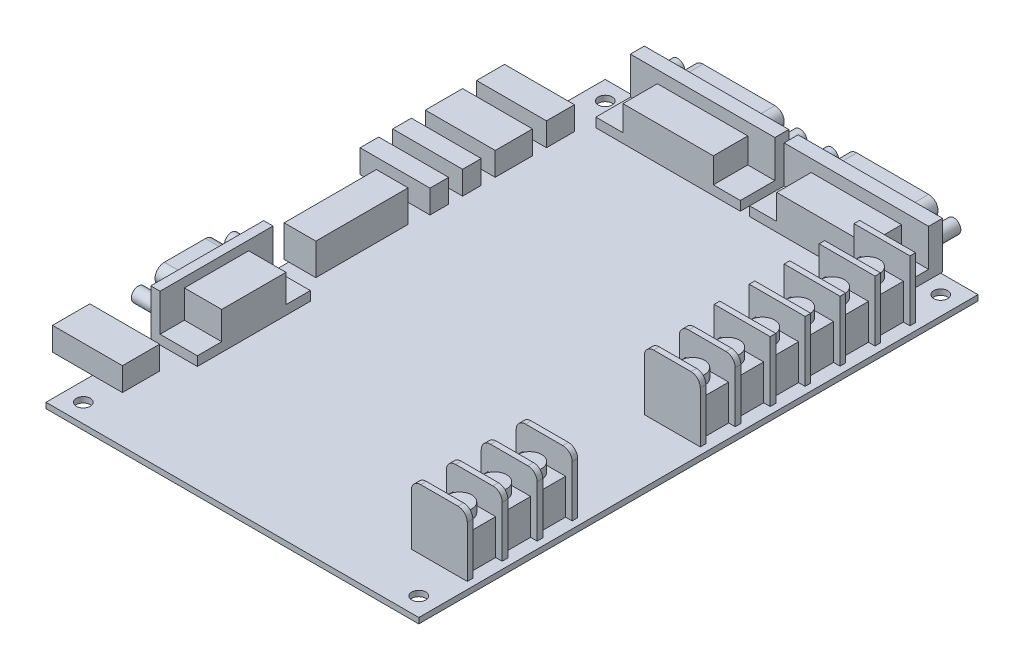
from build123d import *

# Parameters (mm, degrees)
SKETCH1_W              = 101.6
SKETCH1_H              = 152.4
SKETCH1_R              = 1.905
BOSS_EXTRUDE1_DEPTH    = 1.524
SKETCH2_W              = 11.684
SKETCH2_H              = 28.575
SKETCH2_H_2            = 57.15
BOSS_EXTRUDE2_DEPTH    = 9.652
SKETCH3_W              = 15.24
SKETCH3_H              = 1.524
BOSS_EXTRUDE3_DEPTH    = 16.51
FILLET1_R              = 2.54
SKETCH4_R              = 3.302
BOSS_EXTRUDE4_DEPTH    = 2.54
SKETCH5_W              = 15.24
SKETCH5_H              = 1.524
BOSS_EXTRUDE5_DEPTH    = 16.51
FILLET2_R              = 2.54
LPATTERN1_COUNT        = 3
LPATTERN1_PITCH        = 9.525
FILLET2_OF_LPATTERN1_R = 2.54
SKETCH6_W              = 15.24
SKETCH6_H              = 1.524
BOSS_EXTRUDE6_DEPTH    = 16.51
SKETCH7_R              = 3.302
BOSS_EXTRUDE7_DEPTH    = 2.54
FILLET3_R              = 2.54
LPATTERN2_COUNT        = 6
LPATTERN2_PITCH        = 9.525
SKETCH8_W              = 39.37
SKETCH8_H              = 13.208
BOSS_EXTRUDE8_DEPTH    = 2.54
SKETCH9_W              = 24.638
SKETCH9_H              = 13.208
BOSS_EXTRUDE9_DEPTH    = 9.398
SKETCH10_W             = 39.37
SKETCH10_H             = 3.81
BOSS_EXTRUDE10_DEPTH   = 12.7
SKETCH11_R             = 1.905
BOSS_EXTRUDE11_DEPTH   = 6.096
SKETCH12_W             = 12.7
SKETCH12_H             = 30.7848
BOSS_EXTRUDE12_DEPTH   = 2.54
SKETCH13_W             = 12.7
SKETCH13_H             = 17.526
BOSS_EXTRUDE13_DEPTH   = 10.16
SKETCH14_W             = 2.54
SKETCH14_H             = 30.7848
BOSS_EXTRUDE14_DEPTH   = 12.7
SKETCH15_R             = 1.905
BOSS_EXTRUDE15_DEPTH   = 6.096
SKETCH16_W             = 19.05
SKETCH16_H             = 7.62
SKETCH16_H_2           = 10.16
SKETCH16_H_3           = 5.08
BOSS_EXTRUDE16_DEPTH   = 6.35
SKETCH17_W             = 8.636
SKETCH17_H             = 25.146
BOSS_EXTRUDE17_DEPTH   = 8.636


with BuildPart() as part:
    # Sketch1 → Boss-Extrude1 (new body)
    with BuildSketch(Plane(origin=(0, 0, 0), x_dir=(1, 0, 0), z_dir=(0, 1, 0))):
        Rectangle(SKETCH1_W, SKETCH1_H)
        with Locations(Location((45.72, 71.12, 0), (0, 0, 90))):
            Circle(SKETCH1_R, mode=Mode.SUBTRACT)
        with Locations(Location((-45.72, 71.12, 0), (0, 0, 90))):
            Circle(SKETCH1_R, mode=Mode.SUBTRACT)
        with Locations(Location((-45.72, -71.12, 0), (0, 0, 90))):
            Circle(SKETCH1_R, mode=Mode.SUBTRACT)
        with Locations(Location((45.72, -71.12, 0), (0, 0, 90))):
            Circle(SKETCH1_R, mode=Mode.SUBTRACT)
    extrude(amount=BOSS_EXTRUDE1_DEPTH)

    # Sketch2 → Boss-Extrude2 (add)
    with BuildSketch(Plane(origin=(0, 1.524, 0), x_dir=(1, 0, 0), z_dir=(0, 1, 0))):
        with Locations((41.275, -46.0375)):
            Rectangle(SKETCH2_W, SKETCH2_H)
        with Locations((41.275, 31.75)):
            Rectangle(SKETCH2_W, SKETCH2_H_2)
    extrude(amount=BOSS_EXTRUDE2_DEPTH)

    # Sketch3 → Boss-Extrude3 (add)
    with BuildSketch(Plane(origin=(0, 1.524, 0), x_dir=(1, 0, 0), z_dir=(0, 1, 0))):
        with Locations((41.275, -60.325)):
            Rectangle(SKETCH3_W, SKETCH3_H)
        with Locations((41.275, 3.175)):
            Rectangle(SKETCH3_W, SKETCH3_H)
    extrude(amount=BOSS_EXTRUDE3_DEPTH)

    # Fillet1
    fillet1_edges = [part.edges().sort_by_distance(p)[0] for p in [
        (33.655, 18.034, 60.325),
        (48.895, 18.034, 60.325),
        (33.655, 18.034, -3.175),
        (48.895, 18.034, -3.175),
    ]]
    fillet(fillet1_edges, radius=FILLET1_R)

    # Sketch4 → Boss-Extrude4 (add)
    with BuildSketch(Plane(origin=(0, 11.176, 0), x_dir=(1, 0, 0), z_dir=(0, 1, 0))):
        with Locations(Location((41.275, -55.5498, 0), (0, 0, 270))):
            Circle(SKETCH4_R)
    boss_extrude4 = extrude(amount=BOSS_EXTRUDE4_DEPTH)

    # Sketch5 → Boss-Extrude5 (add)
    with BuildSketch(Plane(origin=(0, 1.524, 0), x_dir=(1, 0, 0), z_dir=(0, 1, 0))):
        with Locations((41.275, -50.8)):
            Rectangle(SKETCH5_W, SKETCH5_H)
    boss_extrude5 = extrude(amount=BOSS_EXTRUDE5_DEPTH)

    # Fillet2
    fillet2_edges = [part.edges().sort_by_distance(p)[0] for p in [
        (33.655, 18.034, 50.8),
        (48.895, 18.034, 50.8),
    ]]
    fillet(fillet2_edges, radius=FILLET2_R)

    # LPattern1: Boss-Extrude4, Boss-Extrude5 ×3
    with Locations(*[(0, 0, -i * LPATTERN1_PITCH) for i in range(1, LPATTERN1_COUNT)]):
        add(boss_extrude4)
        add(boss_extrude5)

    # Fillet2 of LPattern1
    fillet2_of_lpattern1_edges = [part.edges().sort_by_distance(p)[0] for p in [
        (33.655, 18.034, 41.275),
        (48.895, 18.034, 41.275),
        (33.655, 18.034, 31.75),
        (48.895, 18.034, 31.75),
    ]]
    fillet(fillet2_of_lpattern1_edges, radius=FILLET2_OF_LPATTERN1_R)

    # Sketch6 → Boss-Extrude6 (add)
    with BuildSketch(Plane(origin=(0, 1.524, 0), x_dir=(1, 0, 0), z_dir=(0, 1, 0))):
        with Locations((41.275, 12.7)):
            Rectangle(SKETCH6_W, SKETCH6_H)
    boss_extrude6 = extrude(amount=BOSS_EXTRUDE6_DEPTH)

    # Sketch7 → Boss-Extrude7 (add)
    with BuildSketch(Plane(origin=(0, 11.176, 0), x_dir=(1, 0, 0), z_dir=(0, 1, 0))):
        with Locations(Location((41.275, 7.9502, 0), (0, 0, 270))):
            Circle(SKETCH7_R)
    boss_extrude7 = extrude(amount=BOSS_EXTRUDE7_DEPTH)

    # Fillet3
    fillet3_edges = [part.edges().sort_by_distance(p)[0] for p in [
        (33.655, 18.034, -12.7),
        (48.895, 18.034, -12.7),
    ]]
    fillet(fillet3_edges, radius=FILLET3_R)

    # LPattern2: Boss-Extrude6, Boss-Extrude7 ×6
    with Locations(*[(0, 0, -i * LPATTERN2_PITCH) for i in range(1, LPATTERN2_COUNT)]):
        add(boss_extrude6)
        add(boss_extrude7)

    # Sketch8 → Boss-Extrude8 (add)
    with BuildSketch(Plane(origin=(0, 1.524, 0), x_dir=(1, 0, 0), z_dir=(0, 1, 0))):
        with Locations((20.955, 70.104)):
            Rectangle(SKETCH8_W, SKETCH8_H)
    boss_extrude8 = extrude(amount=BOSS_EXTRUDE8_DEPTH)

    # Sketch9 → Boss-Extrude9 (add)
    with BuildSketch(Plane(origin=(0, 1.524, 0), x_dir=(1, 0, 0), z_dir=(0, 1, 0))):
        with Locations((20.955, 70.104)):
            Rectangle(SKETCH9_W, SKETCH9_H)
    boss_extrude9 = extrude(amount=BOSS_EXTRUDE9_DEPTH)

    # Sketch10 → Boss-Extrude10 (add)
    with BuildSketch(Plane(origin=(0, 1.524, 0), x_dir=(1, 0, 0), z_dir=(0, 1, 0))):
        with Locations((20.955, 74.803)):
            Rectangle(SKETCH10_W, SKETCH10_H)
    boss_extrude10 = extrude(amount=BOSS_EXTRUDE10_DEPTH)

    # Sketch11 → Boss-Extrude11 (add)
    with BuildSketch(Plane(origin=(0, 0, -76.708), x_dir=(-1, 0, 0), z_dir=(0, 0, -1))):
        with Locations(Location((-4.2926, 7.874, 0), (0, 0, 180))):
            Circle(SKETCH11_R)
        with Locations(Location((-37.6174, 7.874, 0), (0, 0, 180))):
            Circle(SKETCH11_R)
        with BuildLine():
            Line((-11.1506, 11.8618), (-30.7594, 11.8618))
            ThreePointArc((-30.7594, 11.8618), (-32.705152886, 10.954480529), (-33.260811693, 8.880733629))
            Line((-33.260811693, 8.880733629), (-32.750239287, 5.985133629))
            ThreePointArc((-32.750239287, 5.985133629), (-31.881508123, 4.480447114), (-30.248827595, 3.8862))
            Line((-30.248827595, 3.8862), (-11.661172405, 3.8862))
            ThreePointArc((-11.661172405, 3.8862), (-10.028491877, 4.480447114), (-9.159760713, 5.985133629))
            Line((-9.159760713, 5.985133629), (-8.649188307, 8.880733629))
            ThreePointArc((-8.649188307, 8.880733629), (-9.204847114, 10.954480529), (-11.1506, 11.8618))
        make_face()
    boss_extrude11 = extrude(amount=BOSS_EXTRUDE11_DEPTH)

    # Mirror1: Boss-Extrude8, Boss-Extrude9, Boss-Extrude10, Boss-Extrude11 across plane
    add(boss_extrude8.mirror(Plane(origin=(0, 0, 0), x_dir=(0, 0, 1), z_dir=(1, 0, 0))))
    add(boss_extrude9.mirror(Plane(origin=(0, 0, 0), x_dir=(0, 0, 1), z_dir=(1, 0, 0))))
    add(boss_extrude10.mirror(Plane(origin=(0, 0, 0), x_dir=(0, 0, 1), z_dir=(1, 0, 0))))
    add(boss_extrude11.mirror(Plane(origin=(0, 0, 0), x_dir=(0, 0, 1), z_dir=(1, 0, 0))))

    # Sketch12 → Boss-Extrude12 (add)
    with BuildSketch(Plane(origin=(0, 1.524, 0), x_dir=(1, 0, 0), z_dir=(0, 1, 0))):
        with Locations((-44.958, -31.75)):
            Rectangle(SKETCH12_W, SKETCH12_H)
    extrude(amount=BOSS_EXTRUDE12_DEPTH)

    # Sketch13 → Boss-Extrude13 (add)
    with BuildSketch(Plane(origin=(0, 1.524, 0), x_dir=(1, 0, 0), z_dir=(0, 1, 0))):
        with Locations((-44.958, -31.75)):
            Rectangle(SKETCH13_W, SKETCH13_H)
    extrude(amount=BOSS_EXTRUDE13_DEPTH)

    # Sketch14 → Boss-Extrude14 (add)
    with BuildSketch(Plane(origin=(0, 1.524, 0), x_dir=(1, 0, 0), z_dir=(0, 1, 0))):
        with Locations((-50.038, -31.75)):
            Rectangle(SKETCH14_W, SKETCH14_H)
    extrude(amount=BOSS_EXTRUDE14_DEPTH)

    # Sketch15 → Boss-Extrude15 (add)
    with BuildSketch(Plane.ZY.offset(51.308)):
        with Locations(Location((44.45, 7.874, 0), (0, 0, 180))):
            Circle(SKETCH15_R)
        with Locations(Location((19.05, 7.874, 0), (0, 0, 180))):
            Circle(SKETCH15_R)
        with BuildLine():
            Line((26.663614995, 3.9116), (36.836385005, 3.9116))
            ThreePointArc((36.836385005, 3.9116), (38.469065534, 4.505847114), (39.337796698, 6.010533629))
            Line((39.337796698, 6.010533629), (39.839411693, 8.855333629))
            ThreePointArc((39.839411693, 8.855333629), (39.283752886, 10.929080529), (37.338, 11.8364))
            Line((37.338, 11.8364), (26.162, 11.8364))
            ThreePointArc((26.162, 11.8364), (24.216247114, 10.929080529), (23.660588307, 8.855333629))
            Line((23.660588307, 8.855333629), (24.162203302, 6.010533629))
            ThreePointArc((24.162203302, 6.010533629), (25.030934466, 4.505847114), (26.663614995, 3.9116))
        make_face()
    extrude(amount=BOSS_EXTRUDE15_DEPTH)

    # Sketch16 → Boss-Extrude16 (add)
    with BuildSketch(Plane(origin=(0, 1.524, 0), x_dir=(1, 0, 0), z_dir=(0, 1, 0))):
        with Locations((-52.197, 55.88)):
            Rectangle(SKETCH16_W, SKETCH16_H)
        with Locations((-52.197, 43.18)):
            Rectangle(SKETCH16_W, SKETCH16_H_2)
        with Locations((-52.197, 31.75)):
            Rectangle(SKETCH16_W, SKETCH16_H_3)
        with Locations((-52.197, 22.86)):
            Rectangle(SKETCH16_W, SKETCH16_H_3)
        with Locations((-52.197, -58.42)):
            Rectangle(SKETCH16_W, SKETCH16_H_2)
    extrude(amount=BOSS_EXTRUDE16_DEPTH)

    # Sketch17 → Boss-Extrude17 (add)
    with BuildSketch(Plane(origin=(0, 1.524, 0), x_dir=(1, 0, 0), z_dir=(0, 1, 0))):
        with Locations((-47.752, 2.54)):
            Rectangle(SKETCH17_W, SKETCH17_H)
    extrude(amount=BOSS_EXTRUDE17_DEPTH)


solid = part.part
